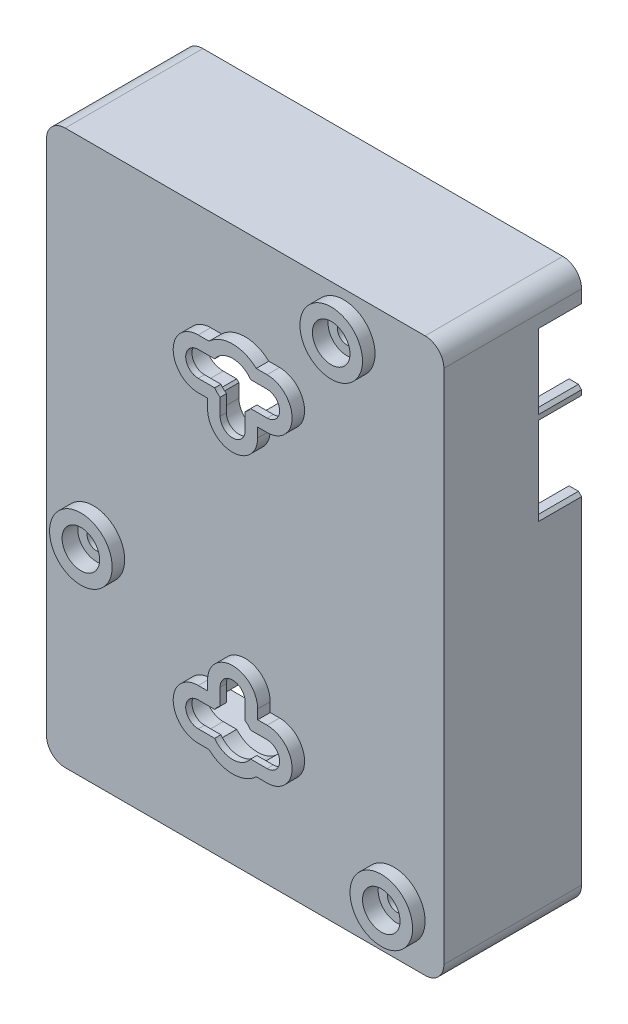
from build123d import *

# Parameters (mm, degrees)
SKETCH2_W           = 63.5
SKETCH2_H           = 88.5
BOSS_EXTRUDE1_DEPTH = 2
SKETCH3_W           = 63.5
SKETCH3_H           = 88.5
SKETCH3_W_2         = 59.5
SKETCH3_H_2         = 84.5
BOSS_EXTRUDE2_DEPTH = 20
SKETCH4_W           = 6.35
SKETCH4_H           = 13
SKETCH4_H_2         = 10.9
CUT_EXTRUDE1_DEPTH  = 2
CHAMFER1_SIZE       = 0.5
SKETCH5_R           = 0.75
SKETCH5_W           = 6.35
SKETCH5_H           = 25
CUT_EXTRUDE3_DEPTH  = 2
FILLET1_R           = 6
SKETCH6_W           = 26.800079737
SKETCH6_H           = 6.35
CUT_EXTRUDE4_DEPTH  = 2
FILLET2_R           = 3
CUT_EXTRUDE5_DEPTH  = 10
BOSS_EXTRUDE3_START = 2
BOSS_EXTRUDE3_DEPTH = 2
SKETCH9_R           = 3.5
SKETCH9_R_2         = 2.5
BOSS_EXTRUDE4_DEPTH = 12.05
SKETCH10_R          = 1.5
CUT_EXTRUDE6_DEPTH  = 76.534322501
SKETCH11_R          = 3
CUT_EXTRUDE7_DEPTH  = 0.5
BOSS_EXTRUDE5_START = 2
SKETCH12_R          = 5
SKETCH12_R_2        = 3
BOSS_EXTRUDE5_DEPTH = 2
CUT_EXTRUDE8_DEPTH  = 3


with BuildPart() as part:
    # Sketch2 → Boss-Extrude1 (new body)
    with BuildSketch(Plane.XY.offset(2)):
        with Locations((-8.071244, 16.046786)):
            Rectangle(SKETCH2_W, SKETCH2_H)
    extrude(amount=BOSS_EXTRUDE1_DEPTH)

    # Sketch3 → Boss-Extrude2 (add)
    with BuildSketch(Plane(origin=(0, 0, 2), x_dir=(-1, 0, 0), z_dir=(0, 0, -1))):
        with Locations((8.071244, 16.046786)):
            Rectangle(SKETCH3_W, SKETCH3_H)
        with Locations((8.071244, 16.046786)):
            Rectangle(SKETCH3_W_2, SKETCH3_H_2, mode=Mode.SUBTRACT)
    extrude(amount=BOSS_EXTRUDE2_DEPTH)

    # Sketch4 → Cut-Extrude1 (cut)
    with BuildSketch(Plane(origin=(23.678756, 0, 0), x_dir=(0, 0, -1), z_dir=(1, 0, 0))):
        with Locations((14.825, 35.546786)):
            Rectangle(SKETCH4_W, SKETCH4_H)
        with Locations((14.825, 49.296786)):
            Rectangle(SKETCH4_W, SKETCH4_H_2)
    extrude(amount=-CUT_EXTRUDE1_DEPTH, mode=Mode.SUBTRACT)

    # Chamfer1
    chamfer1_edges = [part.edges().sort_by_distance(p)[0] for p in [
        (23.678756, 42.046786, -14.825),
        (23.678756, 35.546786, -11.65),
        (23.678756, 29.046786, -14.825),
        (23.678756, 54.746786, -14.825),
        (23.678756, 49.296786, -11.65),
        (23.678756, 43.846786, -14.825),
    ]]
    chamfer(chamfer1_edges, length=CHAMFER1_SIZE)

    # Sketch5 → Cut-Extrude3 (cut)
    with BuildSketch(Plane.ZY.offset(39.821244)):
        with Locations(Location((-12.431991388, 40.654286, 0), (0, 0, 270))):
            Circle(SKETCH5_R)
        with Locations((-14.825, 21.706977335)):
            Rectangle(SKETCH5_W, SKETCH5_H)
    extrude(amount=-CUT_EXTRUDE3_DEPTH, mode=Mode.SUBTRACT)

    # Fillet1
    fillet1_edges = [part.edges().sort_by_distance(p)[0] for p in [
        (-38.821244, 34.206977335, -18),
        (-38.821244, 9.206977335, -18),
    ]]
    fillet(fillet1_edges, radius=FILLET1_R)

    # Sketch6 → Cut-Extrude4 (cut)
    with BuildSketch(Plane.XZ.offset(28.203214)):
        with Locations((-0.390288681, -14.825)):
            Rectangle(SKETCH6_W, SKETCH6_H)
    extrude(amount=-CUT_EXTRUDE4_DEPTH, mode=Mode.SUBTRACT)

    # Fillet2
    fillet2_edges = [part.edges().sort_by_distance(p)[0] for p in [
        (-39.821244, 60.296786, -7),
        (23.678756, 60.296786, -7),
        (23.678756, -28.203214, -7),
        (-39.821244, -28.203214, -7),
    ]]
    fillet(fillet2_edges, radius=FILLET2_R)

    # Sketch7 → Cut-Extrude5 (cut)
    with BuildSketch(Plane.XY.offset(4)):
        with BuildLine():
            Line((-2.571244, -10.203214), (-5.198962677, -10.203214))
            ThreePointArc((-5.198962677, -10.203214), (-8.071244, -11.703214), (-10.943525323, -10.203214))
            Line((-10.943525323, -10.203214), (-13.571244, -10.203214))
            ThreePointArc((-13.571244, -10.203214), (-15.571244, -8.203214), (-13.571244, -6.203214))
            Line((-13.571244, -6.203214), (-10.943525323, -6.203214))
            ThreePointArc((-10.943525323, -6.203214), (-10.546117734, -5.728340266), (-10.071244, -5.330932677))
            Line((-10.071244, -5.330932677), (-10.071244, -2.703214))
            ThreePointArc((-10.071244, -2.703214), (-8.071244, -0.703214), (-6.071244, -2.703214))
            Line((-6.071244, -2.703214), (-6.071244, -5.330932677))
            ThreePointArc((-6.071244, -5.330932677), (-5.596370266, -5.728340266), (-5.198962677, -6.203214))
            Line((-5.198962677, -6.203214), (-2.571244, -6.203214))
            ThreePointArc((-2.571244, -6.203214), (-0.571244, -8.203214), (-2.571244, -10.203214))
        make_face()
        with BuildLine():
            Line((-6.071244, 34.796786), (-6.071244, 37.424504677))
            ThreePointArc((-6.071244, 37.424504677), (-5.596370266, 37.821912266), (-5.198962677, 38.296786))
            Line((-5.198962677, 38.296786), (-2.571244, 38.296786))
            ThreePointArc((-2.571244, 38.296786), (-0.571244, 40.296786), (-2.571244, 42.296786))
            Line((-2.571244, 42.296786), (-5.198962677, 42.296786))
            ThreePointArc((-5.198962677, 42.296786), (-8.071244, 43.796786), (-10.943525323, 42.296786))
            Line((-10.943525323, 42.296786), (-13.571244, 42.296786))
            ThreePointArc((-13.571244, 42.296786), (-15.571244, 40.296786), (-13.571244, 38.296786))
            Line((-13.571244, 38.296786), (-10.943525323, 38.296786))
            ThreePointArc((-10.943525323, 38.296786), (-10.546117734, 37.821912266), (-10.071244, 37.424504677))
            Line((-10.071244, 37.424504677), (-10.071244, 34.796786))
            ThreePointArc((-10.071244, 34.796786), (-8.071244, 32.796786), (-6.071244, 34.796786))
        make_face()
    extrude(amount=-CUT_EXTRUDE5_DEPTH, mode=Mode.SUBTRACT)

    # Sketch8 → Boss-Extrude3 (add)
    with BuildSketch(Plane.XY.offset(4).offset(BOSS_EXTRUDE3_START)):
        with BuildLine():
            Line((-11.846161218, 44.296786), (-13.571244, 44.296786))
            ThreePointArc((-13.571244, 44.296786), (-17.571244, 40.296786), (-13.571244, 36.296786))
            Line((-13.571244, 36.296786), (-12.071244, 36.296786))
            Line((-12.071244, 36.296786), (-12.071244, 34.796786))
            ThreePointArc((-12.071244, 34.796786), (-8.071244, 30.796786), (-4.071244, 34.796786))
            Line((-4.071244, 34.796786), (-4.071244, 36.296786))
            Line((-4.071244, 36.296786), (-2.571244, 36.296786))
            ThreePointArc((-2.571244, 36.296786), (1.428756, 40.296786), (-2.571244, 44.296786))
            Line((-2.571244, 44.296786), (-4.296326782, 44.296786))
            ThreePointArc((-4.296326782, 44.296786), (-8.071244, 45.796786), (-11.846161218, 44.296786))
        make_face()
        with BuildLine():
            Line((-2.571244, 42.296786), (-5.198962677, 42.296786))
            ThreePointArc((-5.198962677, 42.296786), (-8.071244, 43.796786), (-10.943525323, 42.296786))
            Line((-10.943525323, 42.296786), (-13.571244, 42.296786))
            ThreePointArc((-13.571244, 42.296786), (-15.571244, 40.296786), (-13.571244, 38.296786))
            Line((-13.571244, 38.296786), (-10.943525323, 38.296786))
            ThreePointArc((-10.943525323, 38.296786), (-10.546117734, 37.821912266), (-10.071244, 37.424504677))
            Line((-10.071244, 37.424504677), (-10.071244, 34.796786))
            ThreePointArc((-10.071244, 34.796786), (-8.071244, 32.796786), (-6.071244, 34.796786))
            Line((-6.071244, 34.796786), (-6.071244, 37.424504677))
            ThreePointArc((-6.071244, 37.424504677), (-5.596370266, 37.821912266), (-5.198962677, 38.296786))
            Line((-5.198962677, 38.296786), (-2.571244, 38.296786))
            ThreePointArc((-2.571244, 38.296786), (-0.571244, 40.296786), (-2.571244, 42.296786))
        make_face(mode=Mode.SUBTRACT)
    boss_extrude3 = extrude(amount=-BOSS_EXTRUDE3_DEPTH)

    # Sketch9 → Boss-Extrude4 (add)
    with BuildSketch(Plane(origin=(0, 0, 2), x_dir=(-1, 0, 0), z_dir=(0, 0, -1))):
        with Locations(Location((-15.678756, -20.703214, 0), (0, 0, 180))):
            Circle(SKETCH9_R)
        with Locations(Location((32.321244, 5.296786, 0), (0, 0, 180))):
            Circle(SKETCH9_R)
        with Locations(Location((-7.678756, 53.796786, 0), (0, 0, 180))):
            Circle(SKETCH9_R_2)
    extrude(amount=BOSS_EXTRUDE4_DEPTH)

    # Sketch10 → Cut-Extrude6 (cut, through all)
    with BuildSketch(Plane.XY.offset(4)):
        with Locations((7.678756, 53.796786)):
            Circle(SKETCH10_R)
        with Locations((15.678756, -20.703214)):
            Circle(SKETCH10_R)
        with Locations((-32.321244, 5.296786)):
            Circle(SKETCH10_R)
    extrude(amount=-CUT_EXTRUDE6_DEPTH, mode=Mode.SUBTRACT)

    # Sketch11 → Cut-Extrude7 (cut)
    with BuildSketch(Plane.XY.offset(4)):
        with Locations((7.678756, 53.796786)):
            Circle(SKETCH11_R)
        with Locations((-32.321244, 5.296786)):
            Circle(SKETCH11_R)
        with Locations((15.678756, -20.703214)):
            Circle(SKETCH11_R)
    extrude(amount=-CUT_EXTRUDE7_DEPTH, mode=Mode.SUBTRACT)

    # Sketch12 → Boss-Extrude5 (add)
    # profile 1 of 3: a face of its own
    with BuildSketch(Plane.XY.offset(4).offset(BOSS_EXTRUDE5_START)):
        with Locations((7.678756, 53.796786)):
            Circle(SKETCH12_R)
        with Locations((7.678756, 53.796786)):
            Circle(SKETCH12_R_2, mode=Mode.SUBTRACT)
    # profile 2 of 3: a face of its own
    with BuildSketch(Plane.XY.offset(4).offset(BOSS_EXTRUDE5_START)):
        with Locations((-32.321244, 5.296786)):
            Circle(SKETCH12_R)
        with Locations((-32.321244, 5.296786)):
            Circle(SKETCH12_R_2, mode=Mode.SUBTRACT)
    # profile 3 of 3: a face of its own
    with BuildSketch(Plane.XY.offset(4).offset(BOSS_EXTRUDE5_START)):
        with Locations((15.678756, -20.703214)):
            Circle(SKETCH12_R)
        with Locations((15.678756, -20.703214)):
            Circle(SKETCH12_R_2, mode=Mode.SUBTRACT)
    extrude(amount=-BOSS_EXTRUDE5_DEPTH)

    # Sketch13 → Cut-Extrude8 (cut)
    with BuildSketch(Plane(origin=(0, 0, 2), x_dir=(-1, 0, 0), z_dir=(0, 0, -1))):
        with BuildLine():
            Line((13.571244, 43.296786), (11.425345966, 43.296786))
            ThreePointArc((11.425345966, 43.296786), (8.071244, 44.796786), (4.717142034, 43.296786))
            Line((4.717142034, 43.296786), (2.571244, 43.296786))
            ThreePointArc((2.571244, 43.296786), (-0.428756, 40.296786), (2.571244, 37.296786))
            Line((2.571244, 37.296786), (4.717142034, 37.296786))
            ThreePointArc((4.717142034, 37.296786), (4.889263485, 37.114805485), (5.071244, 36.942684034))
            Line((5.071244, 36.942684034), (5.071244, 34.796786))
            ThreePointArc((5.071244, 34.796786), (8.071244, 31.796786), (11.071244, 34.796786))
            Line((11.071244, 34.796786), (11.071244, 36.942684034))
            ThreePointArc((11.071244, 36.942684034), (11.253224515, 37.114805485), (11.425345966, 37.296786))
            Line((11.425345966, 37.296786), (13.571244, 37.296786))
            ThreePointArc((13.571244, 37.296786), (16.571244, 40.296786), (13.571244, 43.296786))
        make_face()
    cut_extrude8 = extrude(amount=-CUT_EXTRUDE8_DEPTH, mode=Mode.SUBTRACT)

    # Mirror1: Boss-Extrude3, Cut-Extrude8 across plane
    add(boss_extrude3.mirror(Plane.ZX.offset(16.046786)))
    add(cut_extrude8.mirror(Plane.ZX.offset(16.046786)), mode=Mode.SUBTRACT)


solid = part.part
